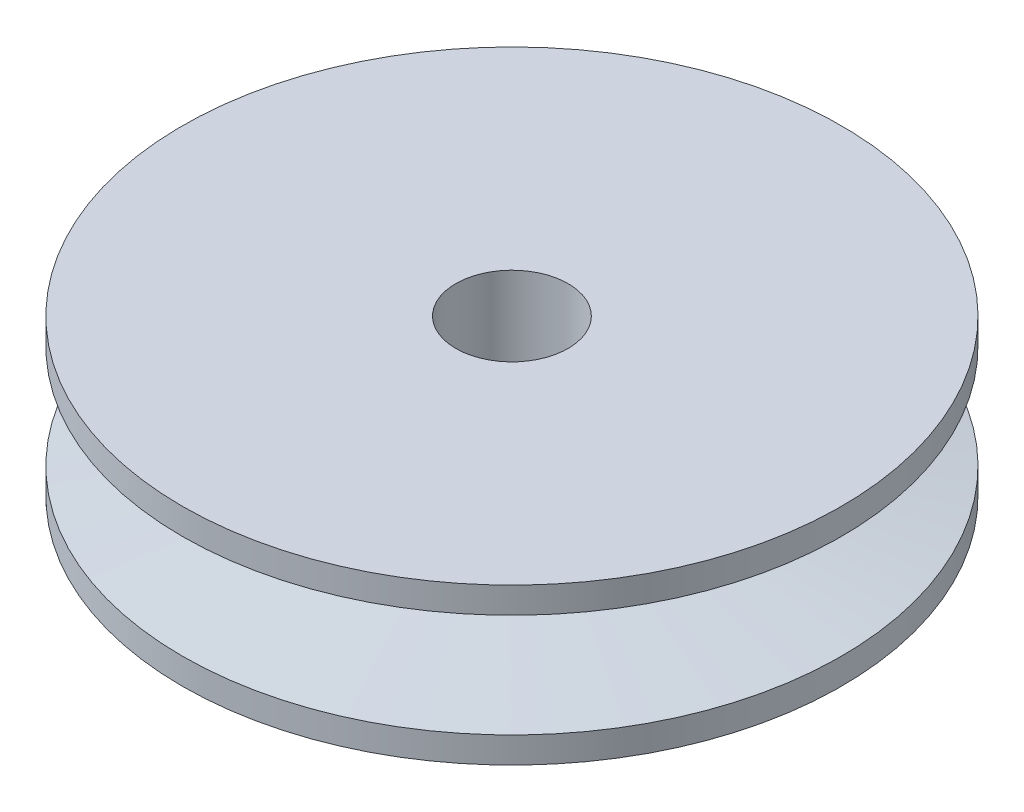
from build123d import *

# Parameters (mm, degrees)
SKETCH2_R          = 7.1
CUT_EXTRUDE1_DEPTH = 63.109057311


with BuildPart() as part:
    # Sketch1 → Revolve1 (revolve)
    with BuildSketch(Plane(origin=(0, 0, 0), x_dir=(0, 0, -1), z_dir=(1, 0, 0)), mode=Mode.PRIVATE) as revolve1_sk:
        Polygon((0, 0), (41.65, 0), (41.65, -3.3), (22.523249986, -6.5), (22.523249986, -13.2), (41.65, -16.4), (41.65, -19.7), (0, -19.7), align=None)
    revolve(revolve1_sk.sketch.rotate(Axis((0, 0, 0), (0, -1, 0)), 180), axis=Axis((0, 0, 0), (0, -1, 0)))

    # Sketch2 → Cut-Extrude1 (cut, through all)
    with BuildSketch(Plane(origin=(0, 0, 0), x_dir=(1, 0, 0), z_dir=(0, 1, 0))):
        with Locations(Location((0, 0, 0), (0, 0, 270))):
            Circle(SKETCH2_R)
    extrude(amount=-CUT_EXTRUDE1_DEPTH, mode=Mode.SUBTRACT)


solid = part.part
